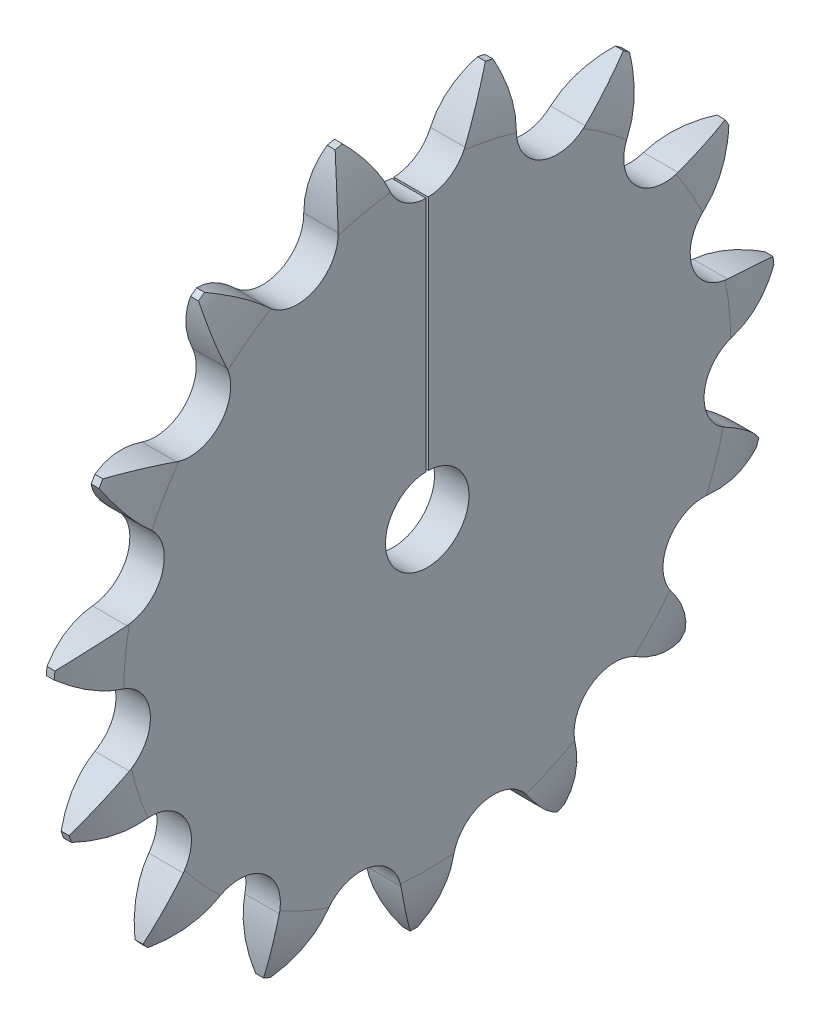
from build123d import *

# Parameters (mm, degrees)
CORTE_EXTRUS_O1_DEPTH = 50.042940369
PADR_OCIRCULAR1_COUNT = 15
ESBO_O3_R             = 4
CORTE_EXTRUS_O2_DEPTH = 49.934541765
ESBO_O4_W             = 0.2
ESBO_O4_H             = 30
CORTE_EXTRUS_O3_DEPTH = 10


with BuildPart() as part:
    # Esboço1 → Revolução1 (revolve)
    with BuildSketch(Plane(origin=(0, 0, 0), x_dir=(1, 0, 0), z_dir=(0, 1, 0)), mode=Mode.PRIVATE) as revolu_o1_sk:
        with BuildLine():
            Line((0, 0), (0, 29.064198342))
            ThreePointArc((0, 29.064198342), (0.321571182, 31.904004673), (1.27, 34.6))
            Line((1.27, 34.6), (2.03, 34.6))
            ThreePointArc((2.03, 34.6), (2.978428818, 31.904004673), (3.3, 29.064198342))
            Line((3.3, 29.064198342), (3.3, 0))
            Line((3.3, 0), (0, 0))
        make_face()
    revolve(revolu_o1_sk.sketch.rotate(Axis((24.686043031, 0, 0), (1, 0, 0)), 180), axis=Axis((24.686043031, 0, 0), (1, 0, 0)))

    # Esboço2 → Corte-extrusão1 (cut, through all)
    with BuildSketch(Plane(origin=(3.3, 0, 0), x_dir=(0, 0, -1), z_dir=(1, 0, 0))):
        with BuildLine():
            ThreePointArc((3.60262587, 29.051339169), (5.165772022, 31.885820751), (7.273437184, 34.342537929))
            ThreePointArc((7.273437184, 34.342537929), (0, 35.104313124), (-7.273437184, 34.342537929))
            ThreePointArc((-7.273437184, 34.342537929), (-5.165772022, 31.885820751), (-3.60262587, 29.051339169))
            ThreePointArc((-3.60262587, 29.051339169), (0, 26.666813124), (3.60262587, 29.051339169))
        make_face()
    corte_extrus_o1 = extrude(amount=-CORTE_EXTRUS_O1_DEPTH, mode=Mode.SUBTRACT)

    # PadrãoCircular1: Corte-extrusão1 ×15 about axis
    padr_ocircular1_axis = Axis((0, 0, 0), (1, 0, 0))
    for i in range(1, PADR_OCIRCULAR1_COUNT):
        add(corte_extrus_o1.rotate(padr_ocircular1_axis, i * 360 / PADR_OCIRCULAR1_COUNT), mode=Mode.SUBTRACT)

    # Esboço3 → Corte-extrusão2 (cut, through all)
    with BuildSketch(Plane(origin=(3.3, 0, 0), x_dir=(0, 0, -1), z_dir=(1, 0, 0))):
        Circle(ESBO_O3_R)
    extrude(amount=-CORTE_EXTRUS_O2_DEPTH, mode=Mode.SUBTRACT)

    # Esboço4 → Corte-extrusão3 (cut)
    with BuildSketch(Plane.ZY):
        with Locations((0, 15)):
            Rectangle(ESBO_O4_W, ESBO_O4_H)
    extrude(amount=-CORTE_EXTRUS_O3_DEPTH, mode=Mode.SUBTRACT)


solid = part.part
